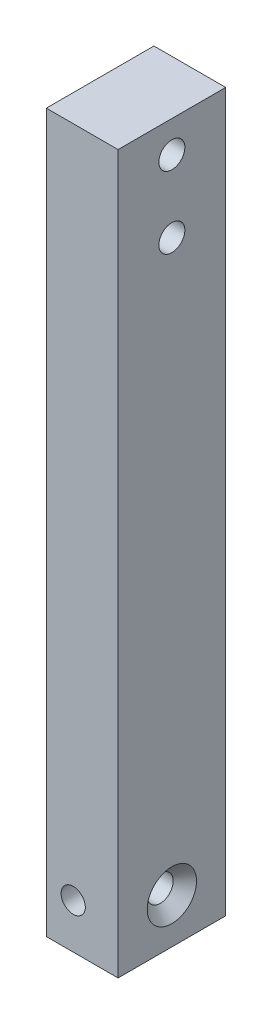
from build123d import *

# Parameters (mm, degrees)
SKETCH_1_W                     = 12
SKETCH_1_H                     = 80
EXTRUDE_1_DEPTH                = 8
SKETCH_2_R                     = 3
CUT_EXTRUDE_1_DEPTH            = 5
HOLE_WIZARD_M2_5_1_D           = 2.9
HOLE_WIZARD_M2_5_1_CSINK_D     = 5.5
HOLE_WIZARD_M2_5_1_CSINK_ANGLE = 90
HOLE_WIZARD_M2_5_2_D           = 2.9
HOLE_WIZARD_M2_5_2_CSINK_D     = 5.5
HOLE_WIZARD_M2_5_2_CSINK_ANGLE = 90
F_1_0MM_2_REACH                = 44.521
F_1_0MM_2_BORE_R               = 1.35


with BuildPart() as part:
    # 草圖1 → 填料-伸長1 (new body)
    with BuildSketch(Plane(origin=(0, 0, 0), x_dir=(0, 0, -1), z_dir=(1, 0, 0))):
        Rectangle(SKETCH_1_W, SKETCH_1_H)
    extrude(amount=EXTRUDE_1_DEPTH)

    # 草圖2 → 除料-伸長1 (cut)
    with BuildSketch(Plane.ZY):
        with Locations((0, -35)):
            Circle(SKETCH_2_R)
    extrude(amount=-CUT_EXTRUDE_1_DEPTH, mode=Mode.SUBTRACT)

    # M2.5 錐坑平頭螺釘的錐孔1 (through all)
    with Locations(Plane(origin=(8, 0, 0), x_dir=(0, 0, -1), z_dir=(1, 0, 0))):
        with Locations((0, -35)):
            CounterSinkHole(HOLE_WIZARD_M2_5_1_D / 2, HOLE_WIZARD_M2_5_1_CSINK_D / 2, counter_sink_angle=HOLE_WIZARD_M2_5_1_CSINK_ANGLE)

    # M2.5 錐坑平頭螺釘的錐孔2 (through all)
    with Locations(Plane.ZY):
        with Locations((0, 36.5), (0, 28.5)):
            CounterSinkHole(HOLE_WIZARD_M2_5_2_D / 2, HOLE_WIZARD_M2_5_2_CSINK_D / 2, counter_sink_angle=HOLE_WIZARD_M2_5_2_CSINK_ANGLE)

    # Ø1.0mm 定位孔2 bore → Ø1.0mm 定位孔2 (cut, up to next)
    with BuildSketch(Plane.XY.offset(6), mode=Mode.PRIVATE) as f_1_0mm_2_sk1:
        with Locations((3, -35)):
            Circle(F_1_0MM_2_BORE_R)
    f_1_0mm_2_tool1 = extrude(f_1_0mm_2_sk1.sketch, amount=-F_1_0MM_2_REACH, mode=Mode.PRIVATE) & part.part
    f_1_0mm_2 = f_1_0mm_2_tool1.solids().sort_by_distance((3, -35, 6))[0]
    add(f_1_0mm_2, mode=Mode.SUBTRACT)

    # 鏡射1: Ø1.0mm 定位孔2 across plane
    add(f_1_0mm_2.mirror(Plane.XY), mode=Mode.SUBTRACT)


solid = part.part
